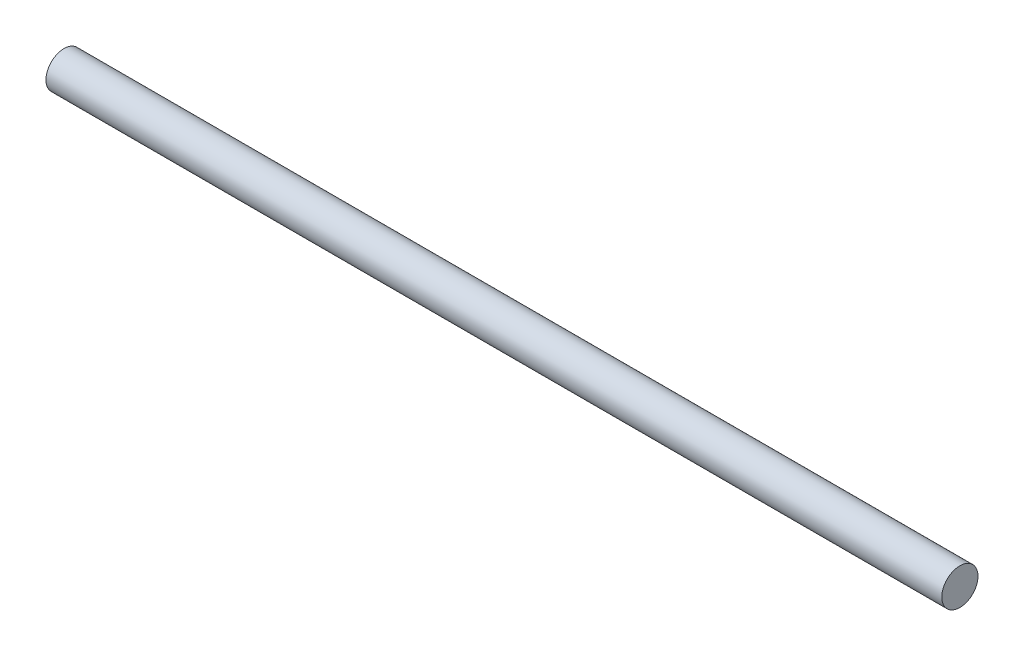
from build123d import *

# Parameters (mm, degrees)
SKETCH1_R           = 0.2921
BOSS_EXTRUDE1_DEPTH = 14.45


with BuildPart() as part:
    # Sketch1 → Boss-Extrude1 (new body)
    with BuildSketch(Plane(origin=(0, 0, 0), x_dir=(0, 0, -1), z_dir=(1, 0, 0))):
        Circle(SKETCH1_R)
    extrude(amount=BOSS_EXTRUDE1_DEPTH)


solid = part.part
